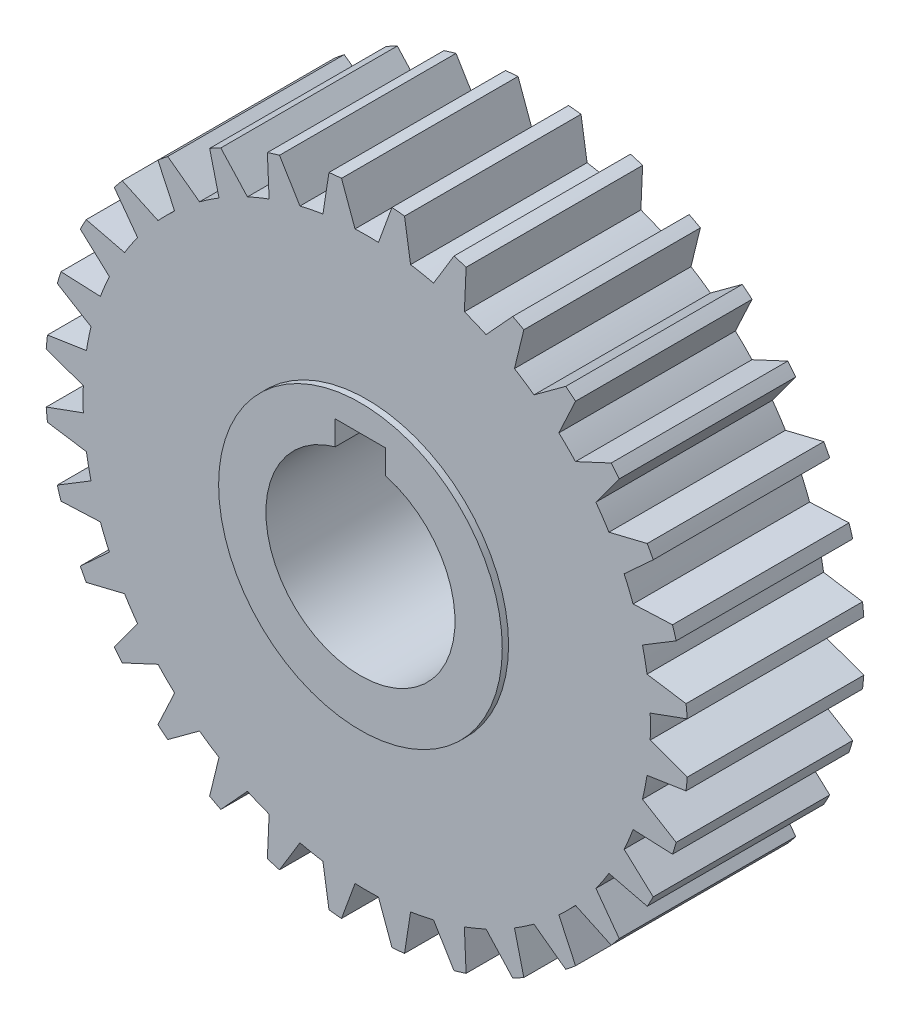
from build123d import *

# Parameters (mm, degrees)
SKETCH_1_R               = 51
EXTRUDE_1_DEPTH          = 28
SKETCH_2_R               = 22.5
EXTRUDE_2_DEPTH          = 1
EXTRUDE_START            = 1
SKETCH_3_R               = 22.5
EXTRUDE_3_DEPTH          = 1
CUT_EXTRUDE_1_REACH      = 80.115
CUT_EXTRUDE_2_REACH      = 79.737
PATTERN_CIRCULAR_1_COUNT = 32


with BuildPart() as part:
    # 草图1 → 凸台-拉伸1 (new body)
    with BuildSketch(Plane.XY):
        Circle(SKETCH_1_R)
    extrude(amount=EXTRUDE_1_DEPTH)

    # 草图2 → 凸台-拉伸2 (add)
    with BuildSketch(Plane(origin=(0, 0, 0), x_dir=(-1, 0, 0), z_dir=(0, 0, -1))):
        with Locations(Location((0, 0, 0), (0, 0, 180))):
            Circle(SKETCH_2_R)
    extrude(amount=EXTRUDE_2_DEPTH)

    # 草图3 → 凸台-拉伸3 (add)
    with BuildSketch(Plane.XY.offset(28).offset(EXTRUDE_START)):
        Circle(SKETCH_3_R)
    extrude(amount=-EXTRUDE_3_DEPTH)

    # 草图4 → 切除-拉伸1 (cut, up to next)
    with BuildSketch(Plane(origin=(0, 0, -1), x_dir=(-1, 0, 0), z_dir=(0, 0, -1)), mode=Mode.PRIVATE) as cut_extrude_1_sk1:
        with BuildLine():
            Line((-4, 18.3), (-4, 14.456832295))
            ThreePointArc((-4, 14.456832295), (0, -15), (4, 14.456832295))
            Line((4, 14.456832295), (4, 18.3))
            Line((4, 18.3), (-4, 18.3))
        make_face()
    cut_extrude_1_tool1 = extrude(cut_extrude_1_sk1.sketch, amount=-CUT_EXTRUDE_1_REACH, mode=Mode.PRIVATE) & part.part
    add(cut_extrude_1_tool1.solids().sort_by_distance((0, 0.627325, -1))[0], mode=Mode.SUBTRACT)

    # 草图5 → 切除-拉伸2 (cut, up to next)
    with BuildSketch(Plane(origin=(0, 0, 0), x_dir=(-1, 0, 0), z_dir=(0, 0, -1)), mode=Mode.PRIVATE) as cut_extrude_2_sk1:
        with BuildLine():
            Line((-4, 50.842895276), (-1.859372488, 44.961569523))
            ThreePointArc((-1.859372488, 44.961569523), (0, 45), (1.859372488, 44.961569523))
            Line((1.859372488, 44.961569523), (4, 50.842895276))
            ThreePointArc((4, 50.842895276), (0, 51), (-4, 50.842895276))
        make_face()
    cut_extrude_2_tool1 = extrude(cut_extrude_2_sk1.sketch, amount=-CUT_EXTRUDE_2_REACH, mode=Mode.PRIVATE) & part.part
    cut_extrude_2 = cut_extrude_2_tool1.solids().sort_by_distance((0, 48.332211, 0))[0]
    add(cut_extrude_2, mode=Mode.SUBTRACT)

    # 阵列(圆周)1: 切除-拉伸2 ×32 about axis
    pattern_circular_1_axis = Axis((0, 0, 0), (0, 0, 1))
    for i in range(1, PATTERN_CIRCULAR_1_COUNT):
        add(cut_extrude_2.rotate(pattern_circular_1_axis, i * 360 / PATTERN_CIRCULAR_1_COUNT), mode=Mode.SUBTRACT)


solid = part.part
